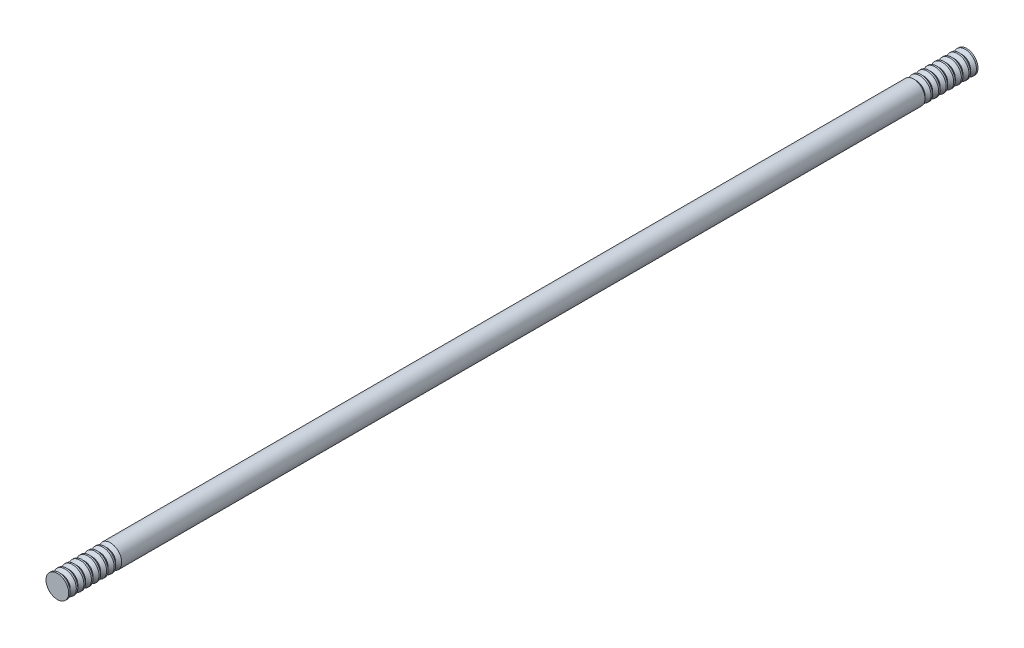
from build123d import *

# Parameters (mm, degrees)
SKETCH1_R           = 1.5
BOSS_EXTRUDE1_DEPTH = 60
LPATTERN1_COUNT     = 7
LPATTERN1_PITCH     = 1


with BuildPart() as part:
    # Sketch1 → Boss-Extrude1 (new, symmetric)
    with BuildSketch(Plane.XY):
        Circle(SKETCH1_R)
    extrude(amount=BOSS_EXTRUDE1_DEPTH, both=True)

    # Sketch2 → Cut-Revolve1 (revolve, cut)
    with BuildSketch(Plane(origin=(0, 0, 0), x_dir=(0, 0, -1), z_dir=(1, 0, 0)), mode=Mode.PRIVATE) as cut_revolve1_sk:
        Polygon((59.8, -1.5), (59.4, -1.1), (59, -1.5), (59, -1.898251276), (59.8, -1.898251276), align=None)
    cut_revolve1 = revolve(cut_revolve1_sk.sketch.rotate(Axis((0, 0, 60), (0, 0, -1)), 270), axis=Axis((0, 0, 60), (0, 0, -1)), mode=Mode.SUBTRACT)

    # LPattern1: Cut-Revolve1 ×7
    with Locations(*[(0, 0, i * LPATTERN1_PITCH) for i in range(1, LPATTERN1_COUNT)]):
        add(cut_revolve1, mode=Mode.SUBTRACT)

    # Mirror1: Cut-Revolve1 across plane
    add(cut_revolve1.mirror(Plane.XY), mode=Mode.SUBTRACT)

    # Mirror1 copy 1 sketch → Mirror1 copy 1 (revolve, cut)
    with BuildSketch(Plane(origin=(0, 0, -1), x_dir=(0, 0, 1), z_dir=(1, 0, 0))):
        Polygon((59.8, 1.5), (59.4, 1.1), (59, 1.5), (59, 1.898251276), (59.8, 1.898251276), align=None)
    revolve(axis=Axis((0, 0, -61), (0, 0, -1)), mode=Mode.SUBTRACT)

    # Mirror1 copy 2 sketch → Mirror1 copy 2 (revolve, cut)
    with BuildSketch(Plane(origin=(0, 0, -2), x_dir=(0, 0, 1), z_dir=(1, 0, 0))):
        Polygon((59.8, 1.5), (59.4, 1.1), (59, 1.5), (59, 1.898251276), (59.8, 1.898251276), align=None)
    revolve(axis=Axis((0, 0, -62), (0, 0, -1)), mode=Mode.SUBTRACT)

    # Mirror1 copy 3 sketch → Mirror1 copy 3 (revolve, cut)
    with BuildSketch(Plane(origin=(0, 0, -3), x_dir=(0, 0, 1), z_dir=(1, 0, 0))):
        Polygon((59.8, 1.5), (59.4, 1.1), (59, 1.5), (59, 1.898251276), (59.8, 1.898251276), align=None)
    revolve(axis=Axis((0, 0, -63), (0, 0, -1)), mode=Mode.SUBTRACT)

    # Mirror1 copy 4 sketch → Mirror1 copy 4 (revolve, cut)
    with BuildSketch(Plane(origin=(0, 0, -4), x_dir=(0, 0, 1), z_dir=(1, 0, 0))):
        Polygon((59.8, 1.5), (59.4, 1.1), (59, 1.5), (59, 1.898251276), (59.8, 1.898251276), align=None)
    revolve(axis=Axis((0, 0, -64), (0, 0, -1)), mode=Mode.SUBTRACT)

    # Mirror1 copy 5 sketch → Mirror1 copy 5 (revolve, cut)
    with BuildSketch(Plane(origin=(0, 0, -5), x_dir=(0, 0, 1), z_dir=(1, 0, 0))):
        Polygon((59.8, 1.5), (59.4, 1.1), (59, 1.5), (59, 1.898251276), (59.8, 1.898251276), align=None)
    revolve(axis=Axis((0, 0, -65), (0, 0, -1)), mode=Mode.SUBTRACT)

    # Mirror1 copy 6 sketch → Mirror1 copy 6 (revolve, cut)
    with BuildSketch(Plane(origin=(0, 0, -6), x_dir=(0, 0, 1), z_dir=(1, 0, 0))):
        Polygon((59.8, 1.5), (59.4, 1.1), (59, 1.5), (59, 1.898251276), (59.8, 1.898251276), align=None)
    revolve(axis=Axis((0, 0, -66), (0, 0, -1)), mode=Mode.SUBTRACT)


solid = part.part
